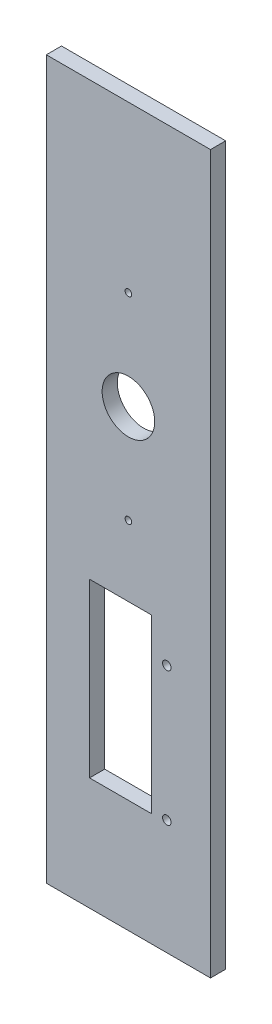
from build123d import *

# Parameters (mm, degrees)
SKETCH1_W           = 68.7
SKETCH1_H           = 293.84
SKETCH1_R           = 1.7859375
SKETCH1_R_2         = 1.3890625
SKETCH1_R_3         = 11
SKETCH1_W_2         = 26
SKETCH1_H_2         = 72
BOSS_EXTRUDE1_DEPTH = 6.35
SKETCH2_W           = 68.7
SKETCH2_H           = 6.35
BOSS_EXTRUDE2_DEPTH = 6.35


with BuildPart() as part:
    # Sketch1 → Boss-Extrude1 (new body)
    with BuildSketch(Plane.XY):
        with Locations((34.35, -146.92)):
            Rectangle(SKETCH1_W, SKETCH1_H)
        with Locations((50.4128, -189.74)):
            Circle(SKETCH1_R, mode=Mode.SUBTRACT)
        with Locations((50.4128, -245.74)):
            Circle(SKETCH1_R, mode=Mode.SUBTRACT)
        with Locations((34.35, -145.2)):
            Circle(SKETCH1_R_2, mode=Mode.SUBTRACT)
        with Locations((34.35, -103.95)):
            Circle(SKETCH1_R_3, mode=Mode.SUBTRACT)
        with Locations((34.35, -62.7)):
            Circle(SKETCH1_R_2, mode=Mode.SUBTRACT)
        with Locations((31.0878, -210.64)):
            Rectangle(SKETCH1_W_2, SKETCH1_H_2, mode=Mode.SUBTRACT)
    extrude(amount=BOSS_EXTRUDE1_DEPTH)

    # Sketch2 → Boss-Extrude2 (add)
    with BuildSketch(Plane(origin=(0, 0, 0), x_dir=(1, 0, 0), z_dir=(0, 1, 0))):
        with Locations((34.35, -3.175)):
            Rectangle(SKETCH2_W, SKETCH2_H)
    extrude(amount=BOSS_EXTRUDE2_DEPTH)


solid = part.part
